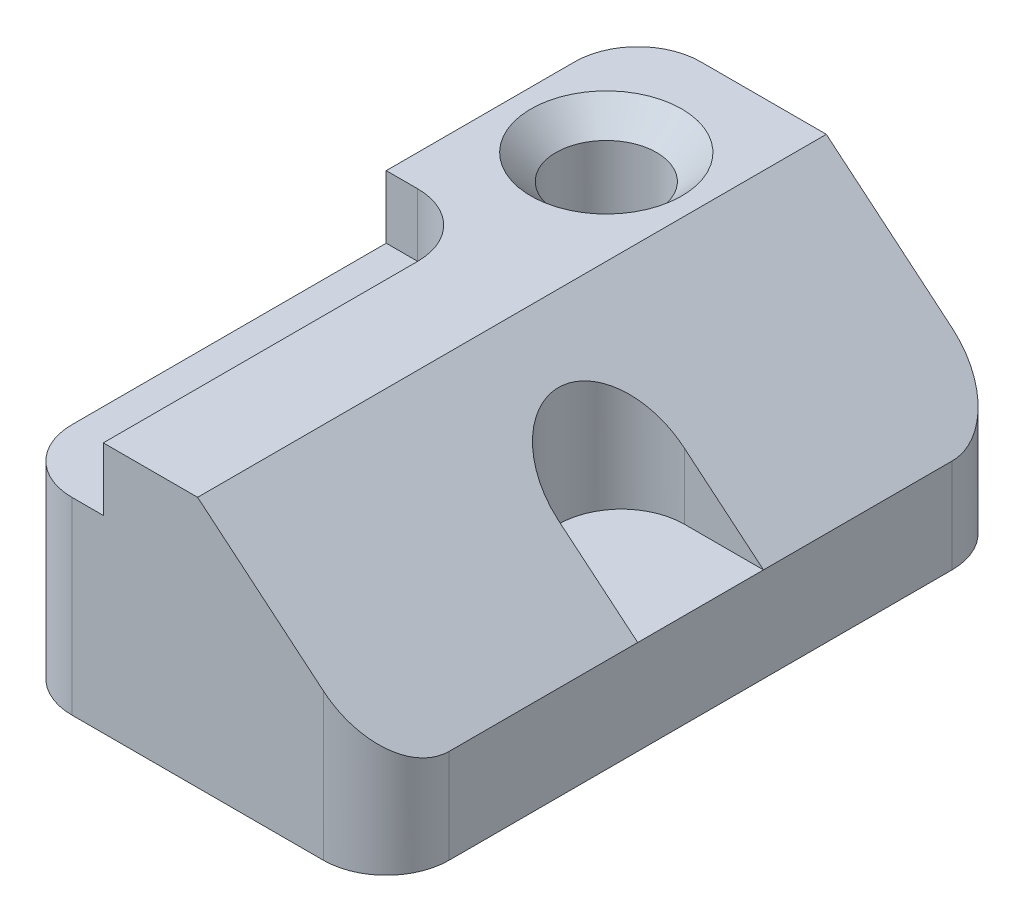
from build123d import *

# Parameters (mm, degrees)
BOSS_EXTRUDE1_DEPTH = 127
SKETCH2_R           = 10.16
CUT_EXTRUDE1_DEPTH  = 157.576115675
CHAMFER1_SIZE       = 5.08
SKETCH3_W           = 19.05
SKETCH3_H           = 76.2
CUT_EXTRUDE2_DEPTH  = 12.7
FILLET1_R           = 12.7
CUT_EXTRUDE4_DEPTH  = 31.75
FILLET2_R           = 12.7


with BuildPart() as part:
    # Sketch1 → Boss-Extrude1 (new body)
    with BuildSketch(Plane.XY):
        Polygon((0, 0), (0, 50.8), (38.1, 50.8), (76.2, 19.05), (76.2, 0), align=None)
    extrude(amount=BOSS_EXTRUDE1_DEPTH)

    # Sketch2 → Cut-Extrude1 (cut, through all)
    with BuildSketch(Plane(origin=(0, 50.8, 0), x_dir=(1, 0, 0), z_dir=(0, 1, 0))):
        with Locations(Location((19.05, -25.4, 0), (0, 0, 270))):
            Circle(SKETCH2_R)
    extrude(amount=-CUT_EXTRUDE1_DEPTH, mode=Mode.SUBTRACT)

    # Chamfer1
    chamfer1_edges = [part.edges().sort_by_distance(p)[0] for p in [
        (19.05, 50.8, 15.24),
    ]]
    chamfer(chamfer1_edges, length=CHAMFER1_SIZE)

    # Sketch3 → Cut-Extrude2 (cut)
    with BuildSketch(Plane(origin=(0, 50.8, 0), x_dir=(1, 0, 0), z_dir=(0, 1, 0))):
        with Locations((9.525, -88.9)):
            Rectangle(SKETCH3_W, SKETCH3_H)
    extrude(amount=-CUT_EXTRUDE2_DEPTH, mode=Mode.SUBTRACT)

    # Fillet1
    fillet1_edges = [part.edges().sort_by_distance(p)[0] for p in [
        (19.05, 44.45, 50.8),
    ]]
    fillet(fillet1_edges, radius=FILLET1_R)

    # Sketch4 → Cut-Extrude4 (cut)
    with BuildSketch(Plane(origin=(0, 50.8, 0), x_dir=(1, 0, 0), z_dir=(0, 1, 0))):
        with BuildLine():
            Line((76.2, -50.8), (60.198, -50.8))
            ThreePointArc((60.198, -50.8), (47.498, -63.5), (60.198, -76.2))
            Line((60.198, -76.2), (76.2, -76.2))
            Line((76.2, -76.2), (76.2, -50.8))
        make_face()
    extrude(amount=-CUT_EXTRUDE4_DEPTH, mode=Mode.SUBTRACT)

    # Fillet2
    fillet2_edges = [part.edges().sort_by_distance(p)[0] for p in [
        (0, 19.05, 127),
        (0, 25.4, 0),
        (76.2, 9.525, 0),
        (76.2, 9.525, 127),
    ]]
    fillet(fillet2_edges, radius=FILLET2_R)


solid = part.part
